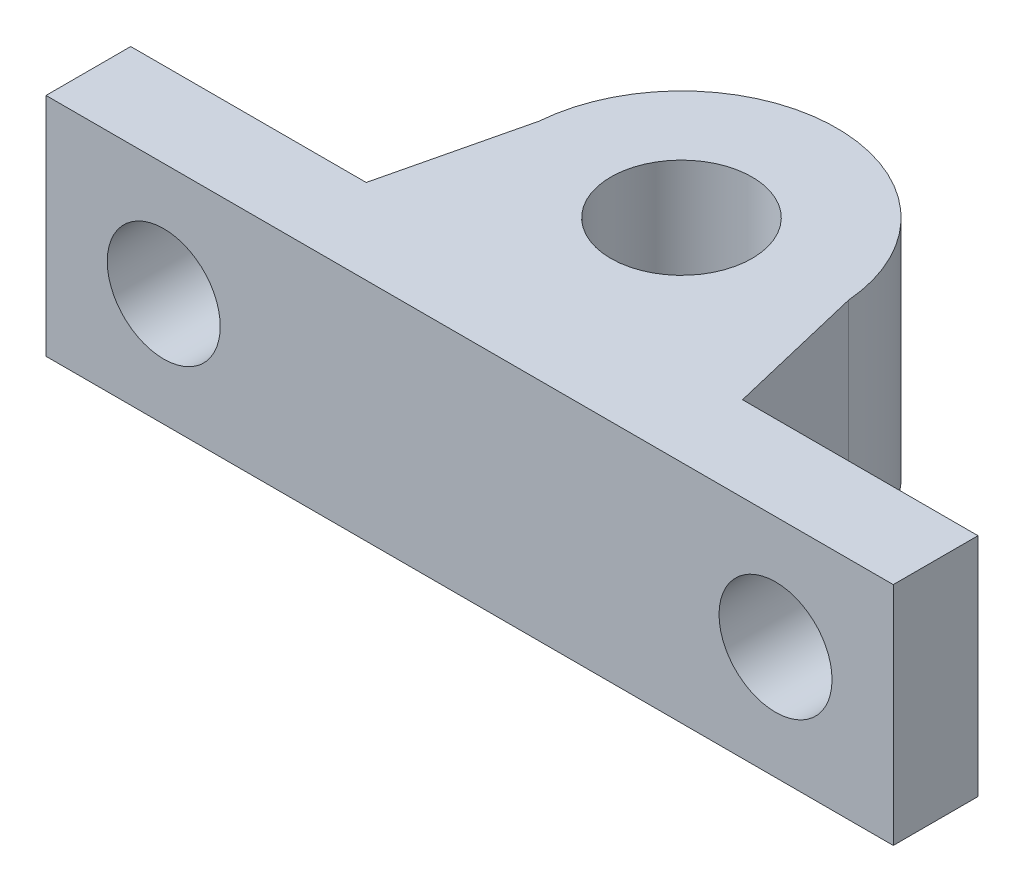
from build123d import *

# Parameters (mm, degrees)
SKETCH1_R           = 5.5
SKETCH1_R_2         = 2.5
BOSS_EXTRUDE1_DEPTH = 8
BOSS_EXTRUDE2_START = -8
BOSS_EXTRUDE2_DEPTH = 8
SKETCH3_R           = 2
CUT_EXTRUDE1_DEPTH  = 8


with BuildPart() as part:
    # Sketch1 → Boss-Extrude1 (new body)
    with BuildSketch(Plane(origin=(0, 0, 0), x_dir=(1, 0, 0), z_dir=(0, 1, 0))):
        with Locations(Location((0, 0, 0), (0, 0, 270))):
            Circle(SKETCH1_R)
        with Locations(Location((0, 0, 0), (0, 0, 270))):
            Circle(SKETCH1_R_2, mode=Mode.SUBTRACT)
    extrude(amount=BOSS_EXTRUDE1_DEPTH)

    # Sketch2 → Boss-Extrude2 (add)
    with BuildSketch(Plane(origin=(0, 8, 0), x_dir=(1, 0, 0), z_dir=(0, 1, 0)).offset(BOSS_EXTRUDE2_START)):
        with BuildLine():
            Line((15, -4.5), (6.662278045, -4.5))
            Line((6.662278045, -4.5), (3.16227766, -4.5))
            ThreePointArc((3.16227766, -4.5), (1.658312395, -5.244044241), (0, -5.5))
            Line((0, -5.5), (0, -7.5))
            Line((0, -7.5), (15, -7.5))
            Line((15, -7.5), (15, -4.5))
        make_face()
        with BuildLine():
            Line((6.662278045, -4.5), (5.4823084, 0.440788615))
            ThreePointArc((5.4823084, 0.440788615), (5.49557532, 0.220571755), (5.5, 0))
            ThreePointArc((5.5, 0), (4.880703184, -2.535495304), (3.16227766, -4.5))
            Line((3.16227766, -4.5), (6.662278045, -4.5))
        make_face()
        with BuildLine():
            ThreePointArc((-3.16227766, -4.5), (-4.978460111, -2.337720027), (-5.4823084, 0.440788615))
            Line((-5.4823084, 0.440788615), (-6.662278045, -4.5))
            Line((-6.662278045, -4.5), (-3.16227766, -4.5))
        make_face()
        with BuildLine():
            Line((-3.16227766, -4.5), (-6.662278045, -4.5))
            Line((-6.662278045, -4.5), (-15, -4.5))
            Line((-15, -4.5), (-15, -7.5))
            Line((-15, -7.5), (0, -7.5))
            Line((0, -7.5), (0, -5.5))
            ThreePointArc((0, -5.5), (-1.658312395, -5.244044241), (-3.16227766, -4.5))
        make_face()
    extrude(amount=BOSS_EXTRUDE2_DEPTH)

    # Sketch3 → Cut-Extrude1 (cut)
    with BuildSketch(Plane(origin=(0, 0, 4.5), x_dir=(-1, 0, 0), z_dir=(0, 0, -1))):
        with BuildLine():
            ThreePointArc((-8.831139022, 4), (-10.831139022, 6), (-12.831139022, 4))
            Line((-12.831139022, 4), (-8.831139022, 4))
        make_face()
        with BuildLine():
            Line((-8.831139022, 4), (-12.831139022, 4))
            ThreePointArc((-12.831139022, 4), (-10.831139022, 2), (-8.831139022, 4))
        make_face()
        with Locations((10.831139022, 4)):
            Circle(SKETCH3_R)
    extrude(amount=-CUT_EXTRUDE1_DEPTH, mode=Mode.SUBTRACT)


solid = part.part
